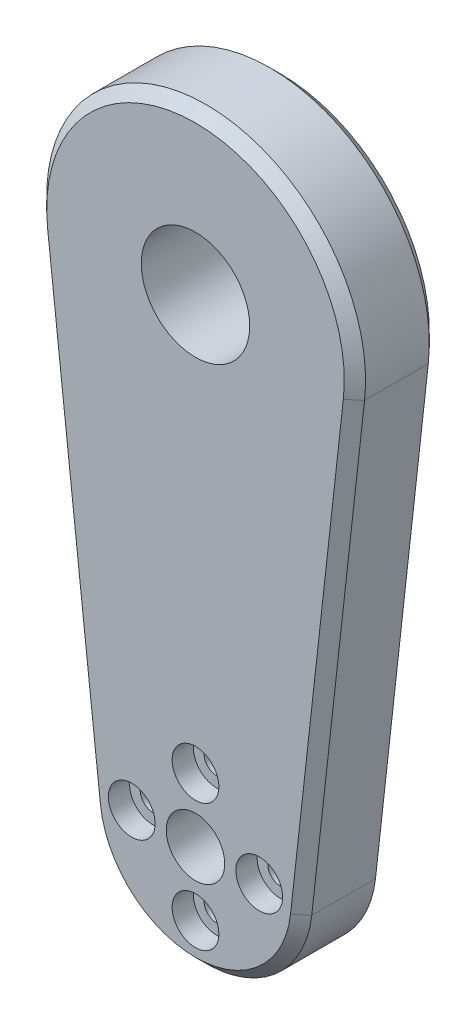
from build123d import *

# Parameters (mm, degrees)
SKETCH1_R                      = 2.75
SKETCH1_R_2                    = 5.1
BOSS_EXTRUDE1_DEPTH            = 8
CBORE_FOR_M2_SHCS1_D           = 2.4
CBORE_FOR_M2_SHCS1_CBORE_D     = 4.4
CBORE_FOR_M2_SHCS1_CBORE_DEPTH = 2
CHAMFER1_SIZE                  = 1


with BuildPart() as part:
    # Sketch1 → Boss-Extrude1 (new body)
    with BuildSketch(Plane.XY):
        with BuildLine():
            Line((9.9380799, -1.111111111), (14.90711985, 43.333333333))
            ThreePointArc((14.90711985, 43.333333333), (0, 60), (-14.90711985, 43.333333333))
            Line((-14.90711985, 43.333333333), (-9.9380799, -1.111111111))
            ThreePointArc((-9.9380799, -1.111111111), (0, -10), (9.9380799, -1.111111111))
        make_face()
        Circle(SKETCH1_R, mode=Mode.SUBTRACT)
        with Locations((0, 45)):
            Circle(SKETCH1_R_2, mode=Mode.SUBTRACT)
    extrude(amount=BOSS_EXTRUDE1_DEPTH)

    # CBORE for M2 SHCS1 (through all)
    with Locations(Plane.XY.offset(8)):
        with Locations((0, -6), (-6, 0), (0, 6), (6, 0)):
            CounterBoreHole(CBORE_FOR_M2_SHCS1_D / 2, CBORE_FOR_M2_SHCS1_CBORE_D / 2, CBORE_FOR_M2_SHCS1_CBORE_DEPTH)

    # Chamfer1
    chamfer1_edges = [part.edges().sort_by_distance(p)[0] for p in [
        (12.422599875, 21.111111111, 8),
        (0, 60, 8),
        (-12.422599875, 21.111111111, 8),
        (0, -10, 8),
        (0, -10, 0),
        (-12.422599875, 21.111111111, 0),
        (0, 60, 0),
        (12.422599875, 21.111111111, 0),
    ]]
    chamfer(chamfer1_edges, length=CHAMFER1_SIZE)


solid = part.part
